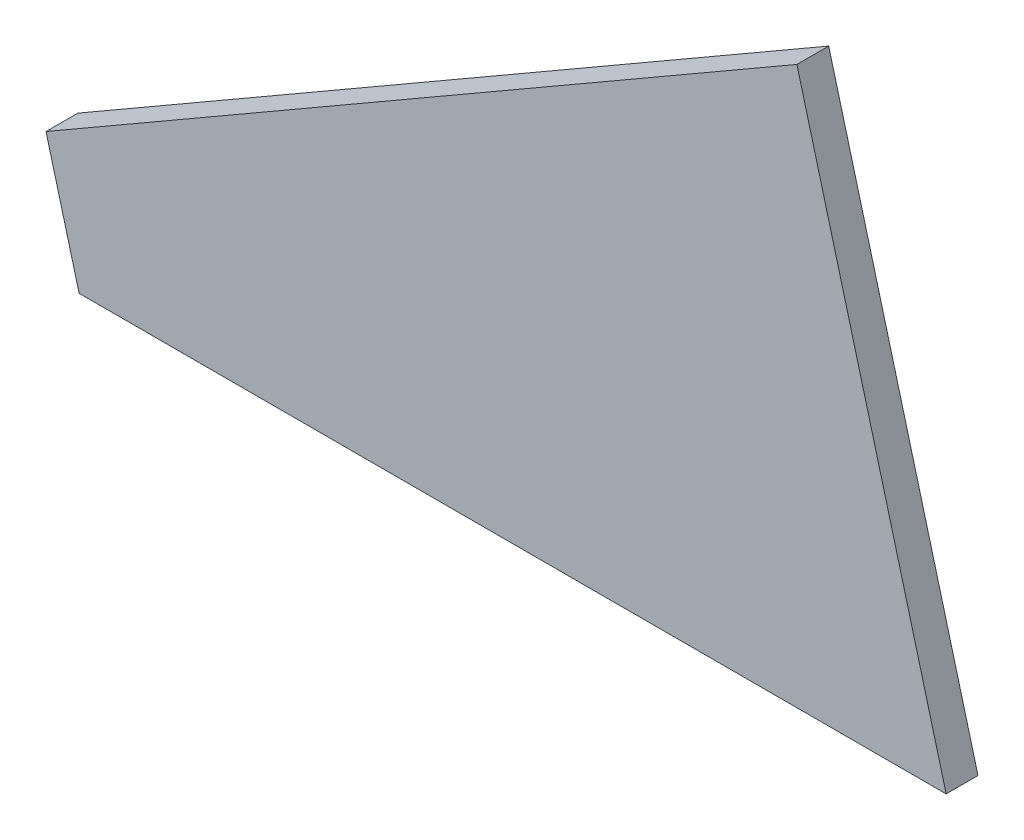
from build123d import *

# Parameters (mm, degrees)
BOSS_EXTRUDE1_DEPTH = 2


with BuildPart() as part:
    # Sketch2 → Boss-Extrude1 (new body)
    with BuildSketch(Plane.XY):
        Polygon((15.53, 0), (13.449374521, 7.765), (60.621778265, 35), (70, 0), align=None)
    extrude(amount=BOSS_EXTRUDE1_DEPTH)


solid = part.part
